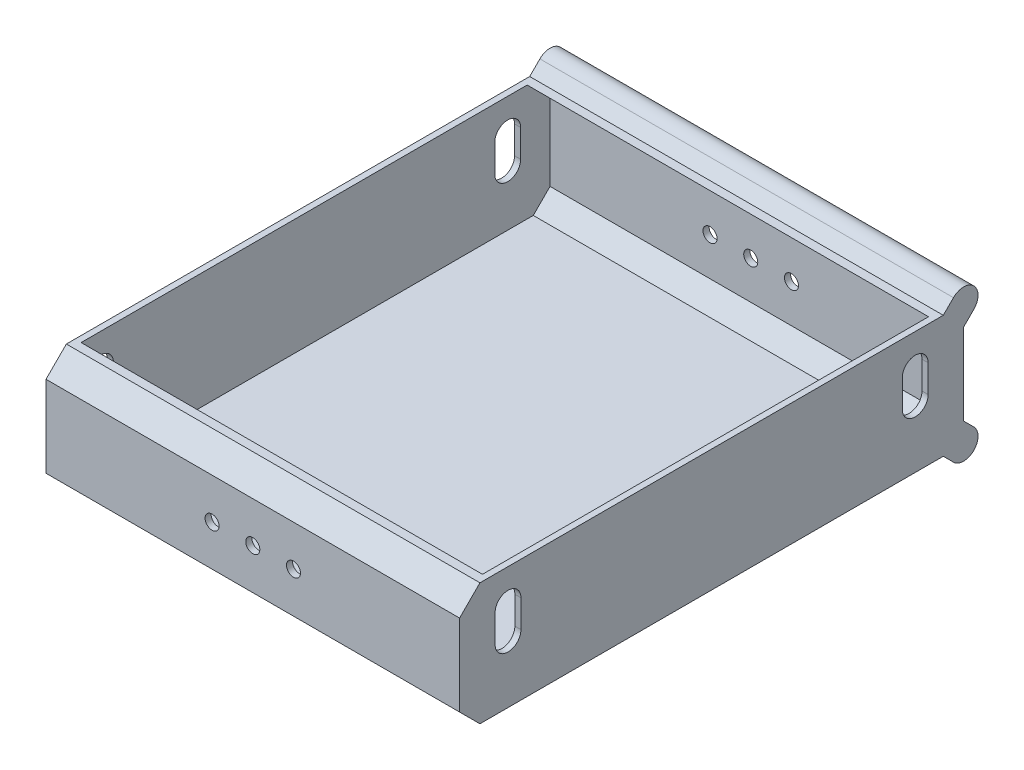
from build123d import *

# Parameters (mm, degrees)
SKETCH1_W                                = 203.2
SKETCH1_H                                = 247.65
BOSS_EXTRUDE1_DEPTH                      = 60
CHAMFER1_SIZE                            = 10
SHELL3_T                                 = -3
CUT_EXTRUDE1_REACH                       = 247.403
MIRROR1_AT_THE_SECOND_PLANE_COPY_1_REACH = 247.403
CUT_EXTRUDE2_REACH                       = 276.323
SKETCH3_R                                = 3.45
BOSS_EXTRUDE2_DEPTH                      = 203.2


with BuildPart() as part:
    # Sketch1 → Boss-Extrude1 (new body)
    with BuildSketch(Plane(origin=(0, 0, 0), x_dir=(1, 0, 0), z_dir=(0, 1, 0))):
        Rectangle(SKETCH1_W, SKETCH1_H)
    extrude(amount=BOSS_EXTRUDE1_DEPTH)

    # Chamfer1
    chamfer1_edges = [part.edges().sort_by_distance(p)[0] for p in [
        (0, 60, 123.825),
        (0, 0, 123.825),
        (0, 0, -123.825),
        (0, 60, -123.825),
    ]]
    chamfer(chamfer1_edges, length=CHAMFER1_SIZE)

    # Shell3
    shell3_openings = [part.faces().sort_by_distance(p)[0] for p in [
        (0, 60, 0),
    ]]
    offset(amount=SHELL3_T, openings=shell3_openings, kind=Kind.INTERSECTION)

    # Sketch2 → Cut-Extrude1 (cut, up to next)
    with BuildSketch(Plane.ZY.offset(101.6), mode=Mode.PRIVATE) as cut_extrude1_sk1:
        with BuildLine():
            Line((-93.675, 43.55), (-93.675, 30))
            ThreePointArc((-93.675, 30), (-100.025, 23.65), (-106.375, 30))
            Line((-106.375, 30), (-106.375, 43.55))
            ThreePointArc((-106.375, 43.55), (-100.025, 49.9), (-93.675, 43.55))
        make_face()
    cut_extrude1_tool1 = extrude(cut_extrude1_sk1.sketch, amount=-CUT_EXTRUDE1_REACH, mode=Mode.PRIVATE) & part.part
    cut_extrude1 = cut_extrude1_tool1.solids().sort_by_distance((-101.6, 36.775, -100.025))[0]
    add(cut_extrude1, mode=Mode.SUBTRACT)

    # Mirror1: Cut-Extrude1 across plane
    add(cut_extrude1.mirror(Plane.XY), mode=Mode.SUBTRACT)

    # Mirror1 at the second plane: Cut-Extrude1 across plane
    add(cut_extrude1.mirror(Plane(origin=(0, 0, 0), x_dir=(0, 0, 1), z_dir=(1, 0, 0))), mode=Mode.SUBTRACT)

    # Mirror1 at the second plane copy 1 sketc → Mirror1 at the second plane copy 1 (cut, up to next)
    with BuildSketch(Plane(origin=(101.6, 0, 0), x_dir=(0, 0, -1), z_dir=(1, 0, 0)), mode=Mode.PRIVATE) as mirror1_at_the_second_plane_copy_1_sk1:
        with BuildLine():
            Line((-93.675, 43.55), (-93.675, 30))
            ThreePointArc((-93.675, 30), (-100.025, 23.65), (-106.375, 30))
            Line((-106.375, 30), (-106.375, 43.55))
            ThreePointArc((-106.375, 43.55), (-100.025, 49.9), (-93.675, 43.55))
        make_face()
    mirror1_at_the_second_plane_copy_1_tool1 = extrude(mirror1_at_the_second_plane_copy_1_sk1.sketch, amount=-MIRROR1_AT_THE_SECOND_PLANE_COPY_1_REACH, mode=Mode.PRIVATE) & part.part
    add(mirror1_at_the_second_plane_copy_1_tool1.solids().sort_by_distance((101.6, 36.775, 100.025))[0], mode=Mode.SUBTRACT)

    # Sketch3 → Cut-Extrude2 (cut, up to next)
    with BuildSketch(Plane(origin=(0, 0, -123.825), x_dir=(-1, 0, 0), z_dir=(0, 0, -1)), mode=Mode.PRIVATE) as cut_extrude2_sk1:
        with Locations((0, 30)):
            Circle(SKETCH3_R)
    cut_extrude2_tool1 = extrude(cut_extrude2_sk1.sketch, amount=-CUT_EXTRUDE2_REACH, mode=Mode.PRIVATE) & part.part
    # Sketch3 → Cut-Extrude2 (cut, up to next)
    with BuildSketch(Plane(origin=(0, 0, -123.825), x_dir=(-1, 0, 0), z_dir=(0, 0, -1)), mode=Mode.PRIVATE) as cut_extrude2_sk2:
        with Locations((20, 30)):
            Circle(SKETCH3_R)
    cut_extrude2_tool2 = extrude(cut_extrude2_sk2.sketch, amount=-CUT_EXTRUDE2_REACH, mode=Mode.PRIVATE) & part.part
    # Sketch3 → Cut-Extrude2 (cut, up to next)
    with BuildSketch(Plane(origin=(0, 0, -123.825), x_dir=(-1, 0, 0), z_dir=(0, 0, -1)), mode=Mode.PRIVATE) as cut_extrude2_sk3:
        with Locations((-20, 30)):
            Circle(SKETCH3_R)
    cut_extrude2_tool3 = extrude(cut_extrude2_sk3.sketch, amount=-CUT_EXTRUDE2_REACH, mode=Mode.PRIVATE) & part.part
    cut_extrude2_1 = cut_extrude2_tool1.solids().sort_by_distance((0, 30, -123.825))[0]
    add(cut_extrude2_1, mode=Mode.SUBTRACT)
    cut_extrude2_2 = cut_extrude2_tool2.solids().sort_by_distance((-20, 30, -123.825))[0]
    add(cut_extrude2_2, mode=Mode.SUBTRACT)
    cut_extrude2_3 = cut_extrude2_tool3.solids().sort_by_distance((20, 30, -123.825))[0]
    add(cut_extrude2_3, mode=Mode.SUBTRACT)
    cut_extrude2 = cut_extrude2_1 + cut_extrude2_2 + cut_extrude2_3  # Cut-Extrude2 as one shape, for the pattern or mirror that repeats it

    # Mirror2: Cut-Extrude2 across plane
    add(cut_extrude2.mirror(Plane.XY), mode=Mode.SUBTRACT)

    # Sketch4 → Boss-Extrude2 (add)
    with BuildSketch(Plane.ZY.offset(101.6)):
        with BuildLine():
            Line((-123.825, 50), (-128.825, 55))
            ThreePointArc((-128.825, 55), (-128.825, 65), (-118.825, 65))
            Line((-118.825, 65), (-113.825, 60))
            Line((-113.825, 60), (-123.825, 50))
        make_face()
        with BuildLine():
            Line((-123.825, 10), (-113.825, 0))
            Line((-113.825, 0), (-118.825, -5))
            ThreePointArc((-118.825, -5), (-128.825, -5), (-128.825, 5))
            Line((-128.825, 5), (-123.825, 10))
        make_face()
    extrude(amount=-BOSS_EXTRUDE2_DEPTH)


solid = part.part
